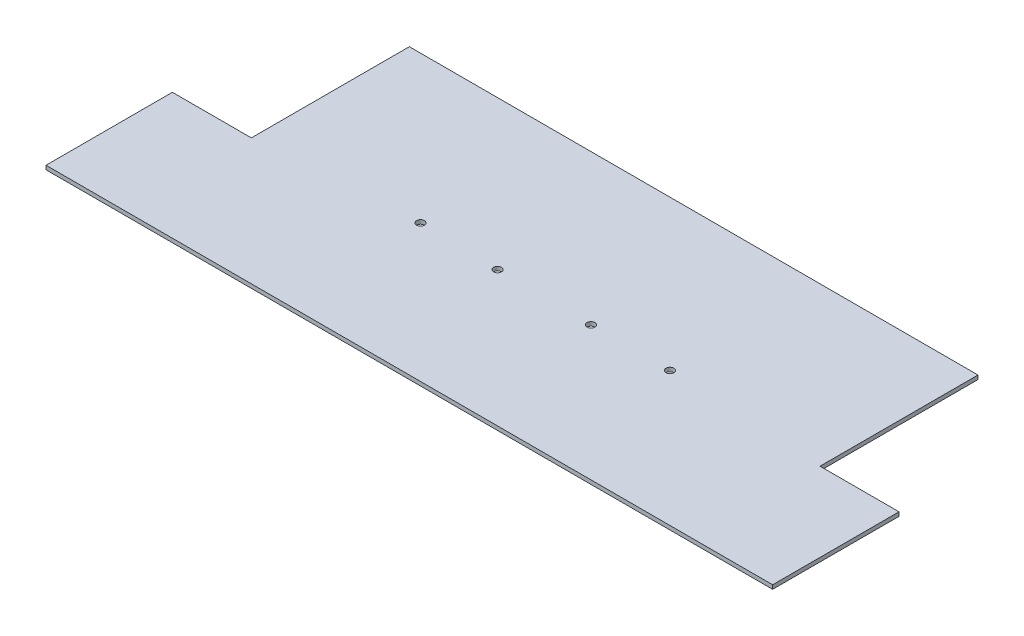
from build123d import *

# Parameters (mm, degrees)
BOSS_EXTRUDE1_DEPTH         = 3.175
F_1_4_0_25_DIAMETER_HOLE1_D = 6.35


with BuildPart() as part:
    # Sketch1 → Boss-Extrude1 (new body)
    with BuildSketch(Plane.XZ.offset(25.4)):
        Polygon((292.1, -215.9), (292.1, -114.3), (0, -114.3), (0, -342.9), (228.6, -342.9), (228.6, -215.9), align=None)
        Polygon((0, -342.9), (0, -114.3), (-292.1, -114.3), (-292.1, -215.9), (-228.6, -215.9), (-228.6, -342.9), align=None)
    extrude(amount=BOSS_EXTRUDE1_DEPTH)

    # 1/4 (0.25) Diameter Hole1 (through all)
    with Locations(Plane(origin=(0, -25.4, 0), x_dir=(1, 0, 0), z_dir=(0, 1, 0))):
        with Locations((-37.935064693, 223.17071982), (-101.416445229, 224.708356097), (38.1, 222.25), (101.6, 222.25)):
            Hole(F_1_4_0_25_DIAMETER_HOLE1_D / 2)


solid = part.part
